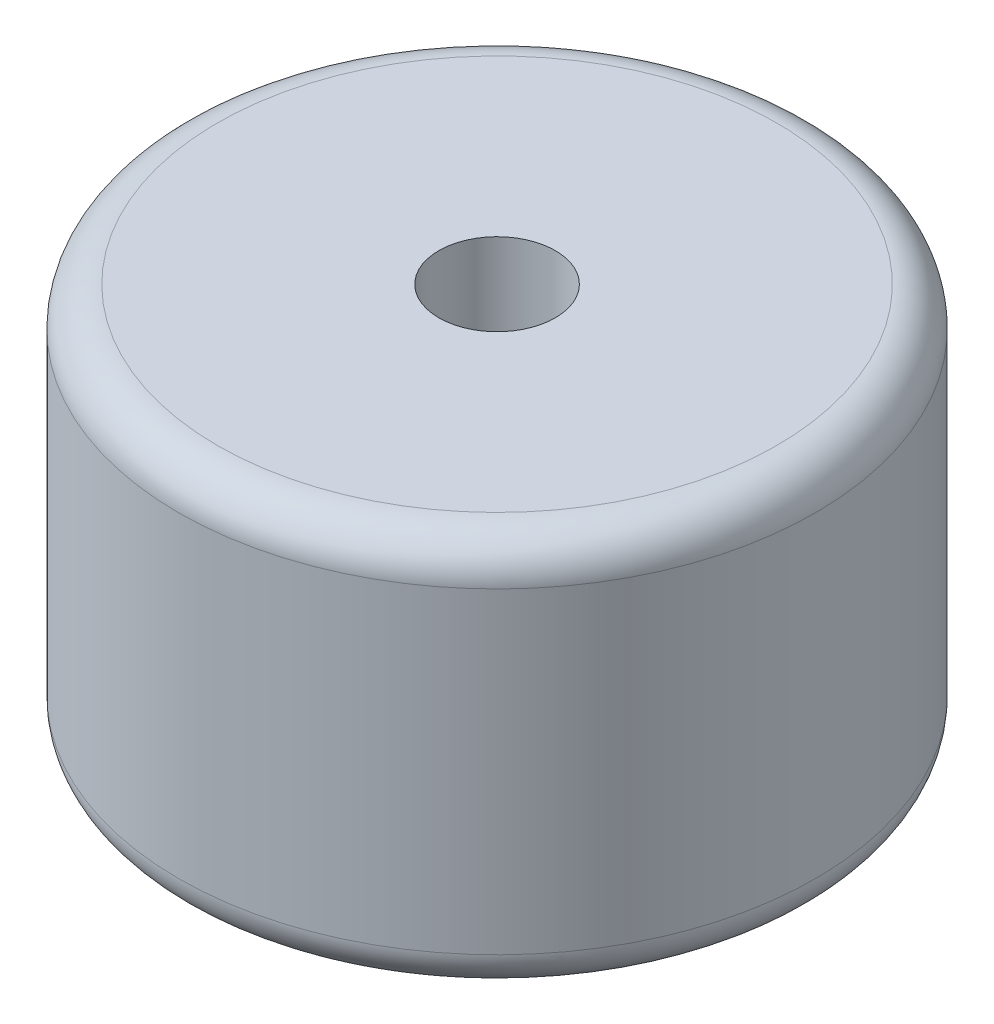
from build123d import *

# Parameters (mm, degrees)
SKETCH1_R               = 41
BOSS_EXTRUDE1_DEPTH     = 25.4
FILLET1_R               = 5
CUT_EXTRUDE1_DEPTH      = 78.088520653
CUT_EXTRUDE1_DEPTH_BACK = 78.088520653
SKETCH2_R               = 7.5


with BuildPart() as part:
    # Sketch1 → Boss-Extrude1 (new, symmetric)
    with BuildSketch(Plane(origin=(0, 0, 0), x_dir=(1, 0, 0), z_dir=(0, 1, 0))):
        with Locations(Location((0, 0, 0), (0, 0, 270))):
            Circle(SKETCH1_R)
    extrude(amount=BOSS_EXTRUDE1_DEPTH, both=True)

    # Fillet1
    fillet1_edges = [part.edges().sort_by_distance(p)[0] for p in [
        (0, -25.4, -41),
        (0, 25.4, -41),
    ]]
    fillet(fillet1_edges, radius=FILLET1_R)

    # Sketch2 → Cut-Extrude1 (cut, two sides: drawn at the far end of the back side and taken through both)
    with BuildSketch(Plane(origin=(0, 25.4, 0), x_dir=(1, 0, 0), z_dir=(0, 1, 0)).offset(-CUT_EXTRUDE1_DEPTH_BACK)):
        with Locations(Location((0, 0, 0), (0, 0, 270))):
            Circle(SKETCH2_R)
    extrude(amount=CUT_EXTRUDE1_DEPTH + CUT_EXTRUDE1_DEPTH_BACK, mode=Mode.SUBTRACT)


solid = part.part
